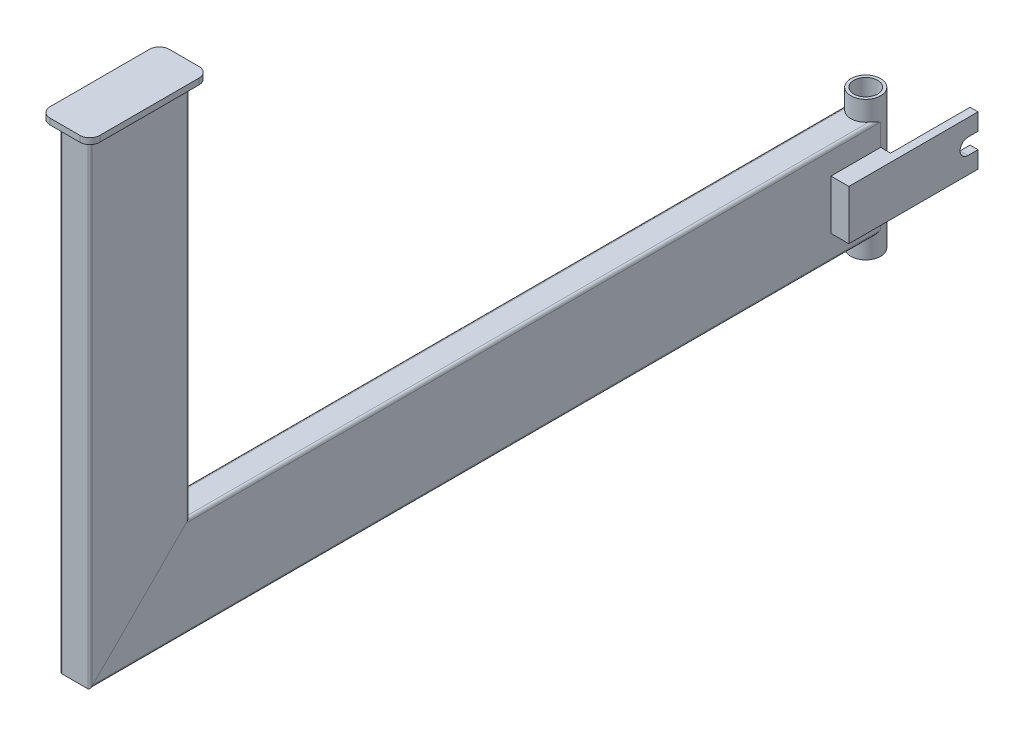
from build123d import *

# Parameters (mm, degrees)
SCHIZZO1_W                        = 24
SCHIZZO1_H                        = 94
ESTRUSIONE_SOTTILE1_DEPTH         = 796
TAGLIO_ESTRUSIONE1_DEPTH          = 803.817538423
ESTRUSIONE_ESTRUSIONE1_DEPTH      = 20
ESTRUSIONE_ESTRUSIONE1_DEPTH_BACK = 120
SCHIZZO3_R                        = 15
SCHIZZO4_R                        = 12
TAGLIO_ESTRUSIONE2_DEPTH          = 809.774381514
SCHIZZO5_W                        = 50
SCHIZZO5_H                        = 50
ESTRUSIONE_ESTRUSIONE2_DEPTH      = 10
ESTRUSIONE_ESTRUSIONE3_DEPTH      = 8
ESTRUSIONE_ESTRUSIONE4_DEPTH      = 15
RACCORDO1_R                       = 2
TAGLIO_ESTRUSIONE3_DEPTH          = 946.776004274
TAGLIO_ESTRUSIONE3_DEPTH_BACK     = 946.776004274
SCHIZZO8_W                        = 24
SCHIZZO8_H                        = 94
ESTRUSIONE_ESTRUSIONE5_DEPTH      = 6


with BuildPart() as part:
    # Schizzo1 → Estrusione-Sottile1 (new body)
    with BuildSketch(Plane.XY):
        with BuildLine():
            Line((0, 97), (0, 3))
            ThreePointArc((0, 3), (0.878679656, 0.878679656), (3, 0))
            Line((3, 0), (27, 0))
            ThreePointArc((27, 0), (29.121320344, 0.878679656), (30, 3))
            Line((30, 3), (30, 97))
            ThreePointArc((30, 97), (29.121320344, 99.121320344), (27, 100))
            Line((27, 100), (3, 100))
            ThreePointArc((3, 100), (0.878679656, 99.121320344), (0, 97))
        make_face()
        with Locations((15, 50)):
            Rectangle(SCHIZZO1_W, SCHIZZO1_H, mode=Mode.SUBTRACT)
    extrude(amount=ESTRUSIONE_SOTTILE1_DEPTH)

    # Schizzo2 → Taglio-Estrusione1 (cut, through all)
    with BuildSketch(Plane(origin=(30, 0, 0), x_dir=(0, 0, -1), z_dir=(1, 0, 0))):
        Polygon((-796, 100), (-696, 100), (-796, 0), align=None)
    extrude(amount=-TAGLIO_ESTRUSIONE1_DEPTH, mode=Mode.SUBTRACT)

    # Schizzo3 → Estrusione-Estrusione1 (add, two sides: drawn at the far end of the back side and taken through both)
    with BuildSketch(Plane(origin=(0, 100, 0), x_dir=(1, 0, 0), z_dir=(0, 1, 0)).offset(-ESTRUSIONE_ESTRUSIONE1_DEPTH_BACK)):
        with Locations(Location((15, 0, 0), (0, 0, 270))):
            Circle(SCHIZZO3_R)
    extrude(amount=ESTRUSIONE_ESTRUSIONE1_DEPTH + ESTRUSIONE_ESTRUSIONE1_DEPTH_BACK)

    # Schizzo4 → Taglio-Estrusione2 (cut, through all)
    with BuildSketch(Plane(origin=(0, 120, 0), x_dir=(1, 0, 0), z_dir=(0, 1, 0))):
        with Locations(Location((15, 0, 0), (0, 0, 270))):
            Circle(SCHIZZO4_R)
    extrude(amount=-TAGLIO_ESTRUSIONE2_DEPTH, mode=Mode.SUBTRACT)

    # Schizzo5 → Estrusione-Estrusione2 (add)
    with BuildSketch(Plane(origin=(30, 0, 0), x_dir=(0, 0, -1), z_dir=(1, 0, 0))):
        with Locations((-25, 50)):
            Rectangle(SCHIZZO5_W, SCHIZZO5_H)
    extrude(amount=ESTRUSIONE_ESTRUSIONE2_DEPTH)

    # Schizzo6 → Estrusione-Estrusione3 (add)
    with BuildSketch(Plane(origin=(40, 0, 0), x_dir=(0, 0, -1), z_dir=(1, 0, 0))):
        with BuildLine():
            Line((-50, 75), (80, 75))
            Line((80, 75), (80, 58))
            Line((80, 58), (70, 58))
            ThreePointArc((70, 58), (62, 50), (70, 42))
            Line((70, 42), (80, 42))
            Line((80, 42), (80, 25))
            Line((80, 25), (-50, 25))
            Line((-50, 25), (-50, 75))
        make_face()
    extrude(amount=ESTRUSIONE_ESTRUSIONE3_DEPTH)


with BuildPart() as body_2:
    # Schizzo7 → Estrusione-Estrusione4 (new, symmetric)
    with BuildSketch(Plane(origin=(15, 0, 0), x_dir=(0, 0, -1), z_dir=(1, 0, 0))):
        Polygon((-796, 488.5), (-696, 488.5), (-696, 100), (-796, 0), align=None)
    extrude(amount=ESTRUSIONE_ESTRUSIONE4_DEPTH, both=True)

    # Raccordo1
    raccordo1_edges = [body_2.edges().sort_by_distance(p)[0] for p in [
        (30, 244.25, 796),
        (0, 244.25, 796),
        (0, 294.25, 696),
        (30, 294.25, 696),
    ]]
    fillet(raccordo1_edges, radius=RACCORDO1_R)

    # Schizzo8 → Taglio-Estrusione3 (cut, two sides: drawn at the far end of the back side and taken through both)
    with BuildSketch(Plane(origin=(0, 488.5, 0), x_dir=(1, 0, 0), z_dir=(0, 1, 0)).offset(-TAGLIO_ESTRUSIONE3_DEPTH_BACK)):
        with Locations((15, -746)):
            Rectangle(SCHIZZO8_W, SCHIZZO8_H)
    extrude(amount=TAGLIO_ESTRUSIONE3_DEPTH + TAGLIO_ESTRUSIONE3_DEPTH_BACK, mode=Mode.SUBTRACT)

    # Schizzo9 → Estrusione-Estrusione5 (add)
    with BuildSketch(Plane(origin=(0, 488.5, 0), x_dir=(1, 0, 0), z_dir=(0, 1, 0))):
        with BuildLine():
            Line((0, -806), (30, -806))
            ThreePointArc((30, -806), (37.071067812, -803.071067812), (40, -796))
            Line((40, -796), (40, -696))
            ThreePointArc((40, -696), (37.071067812, -688.928932188), (30, -686))
            Line((30, -686), (0, -686))
            ThreePointArc((0, -686), (-7.071067812, -688.928932188), (-10, -696))
            Line((-10, -696), (-10, -796))
            ThreePointArc((-10, -796), (-7.071067812, -803.071067812), (0, -806))
        make_face()
    extrude(amount=-ESTRUSIONE_ESTRUSIONE5_DEPTH)


solid = Compound([part.part, body_2.part])
